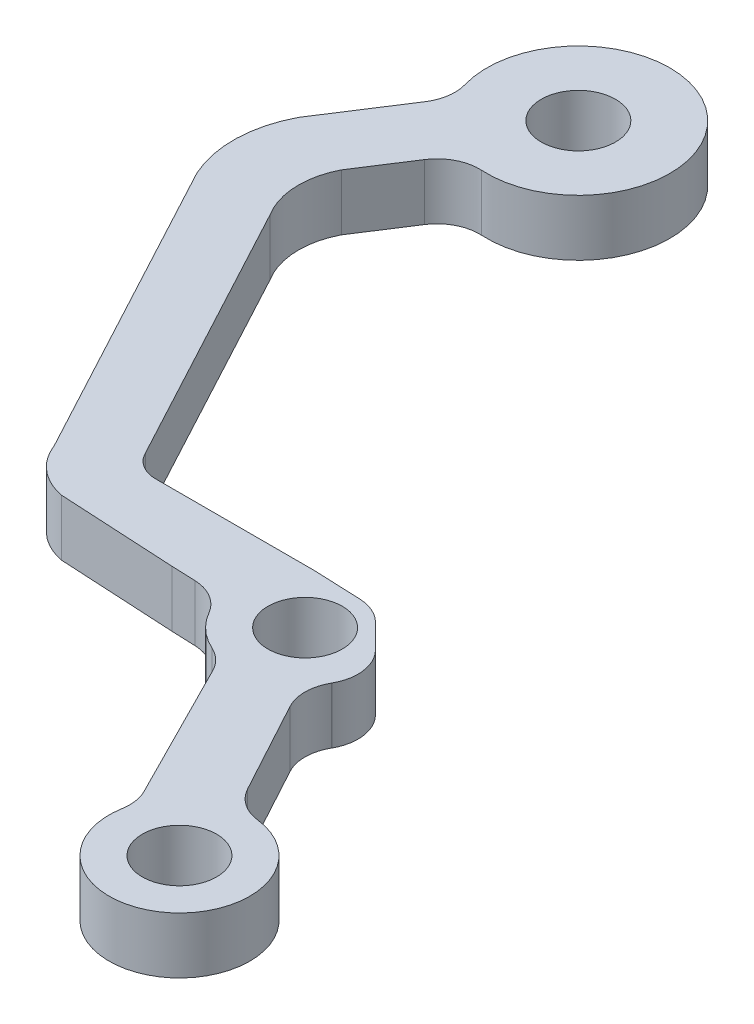
from build123d import *

# Parameters (mm, degrees)
SKETCH1_R           = 2.6375
BOSS_EXTRUDE1_DEPTH = 4


with BuildPart() as part:
    # Sketch1 → Boss-Extrude1 (new body)
    with BuildSketch(Plane(origin=(0, 4, 0), x_dir=(1, 0, 0), z_dir=(0, 1, 0))):
        with BuildLine():
            Line((80.422342857, 54.050517259), (76.853623233, 60.632336961))
            ThreePointArc((76.853623233, 60.632336961), (76.491061204, 62.093363418), (76.883808504, 63.546566463))
            ThreePointArc((76.883808504, 63.546566463), (76.887801931, 63.553594024), (76.891783993, 63.560628031))
            ThreePointArc((76.891783993, 63.560628031), (77.252393533, 65.441834253), (76.401227258, 67.157786484))
            Line((76.401227258, 67.157786484), (74.710106586, 68.848907157))
            ThreePointArc((74.710106586, 68.848907157), (73.793959033, 69.474868842), (72.712949954, 69.725016274))
            Line((72.712949954, 69.725016274), (69.341583584, 69.864669723))
            Line((69.341583584, 69.864669723), (58.04793187, 69.864669723))
            ThreePointArc((58.04793187, 69.864669723), (56.905384642, 70.210123831), (56.115987655, 71.105447853))
            Line((56.115987655, 71.105447853), (45.913475043, 90.139986308))
            ThreePointArc((45.913475043, 90.139986308), (45.078544808, 92.769966676), (45.661998303, 95.466907026))
            Line((45.661998303, 95.466907026), (47.984386737, 99.06049755))
            ThreePointArc((47.984386737, 99.06049755), (49.146460916, 100.107430356), (50.677561656, 100.427141511))
            ThreePointArc((50.677561656, 100.427141511), (55.107636105, 111.997063252), (44.809847991, 105.109087593))
            ThreePointArc((44.809847991, 105.109087593), (44.89620964, 103.838561027), (44.447757125, 102.646677462))
            Line((44.447757125, 102.646677462), (40.917682236, 97.184351056))
            ThreePointArc((40.917682236, 97.184351056), (40.000914232, 93.684113367), (40.729811239, 90.139986308))
            Line((40.729811239, 90.139986308), (52.448751423, 68.276291936))
            ThreePointArc((52.448751423, 68.276291936), (53.733769558, 66.46917356), (55.737555004, 65.519546097))
            Line((55.737555004, 65.519546097), (64.043852088, 65.068697747))
            Line((64.043852088, 65.068697747), (65.737001521, 65.002354827))
            ThreePointArc((65.737001521, 65.002354827), (67.167212394, 64.574619561), (68.214209712, 63.510543803))
            ThreePointArc((68.214209712, 63.510543803), (69.182612076, 62.314016036), (70.4690978, 61.468772687))
            ThreePointArc((70.4690978, 61.468772687), (71.304443417, 60.902477838), (71.904734595, 60.091217919))
            Line((71.904734595, 60.091217919), (76.886572185, 50.235843556))
            ThreePointArc((76.886572185, 50.235843556), (77.175676431, 49.329685255), (77.166582589, 48.378569367))
            ThreePointArc((77.166582589, 48.378569367), (85.084005766, 43.530139369), (82.698094563, 52.502334805))
            ThreePointArc((82.698094563, 52.502334805), (81.37218956, 53.000032473), (80.422342857, 54.050517259))
        make_face()
        with Locations(Location((51.053576092, 106.916256485, 0), (0, 0, 90))):
            Circle(SKETCH1_R, mode=Mode.SUBTRACT)
        with Locations(Location((82.095552315, 47.538773298, 0), (0, 0, 90))):
            Circle(SKETCH1_R, mode=Mode.SUBTRACT)
        with Locations(Location((72.538655529, 66.020358214, 0), (0, 0, 90))):
            Circle(SKETCH1_R, mode=Mode.SUBTRACT)
    extrude(amount=-BOSS_EXTRUDE1_DEPTH)


solid = part.part
